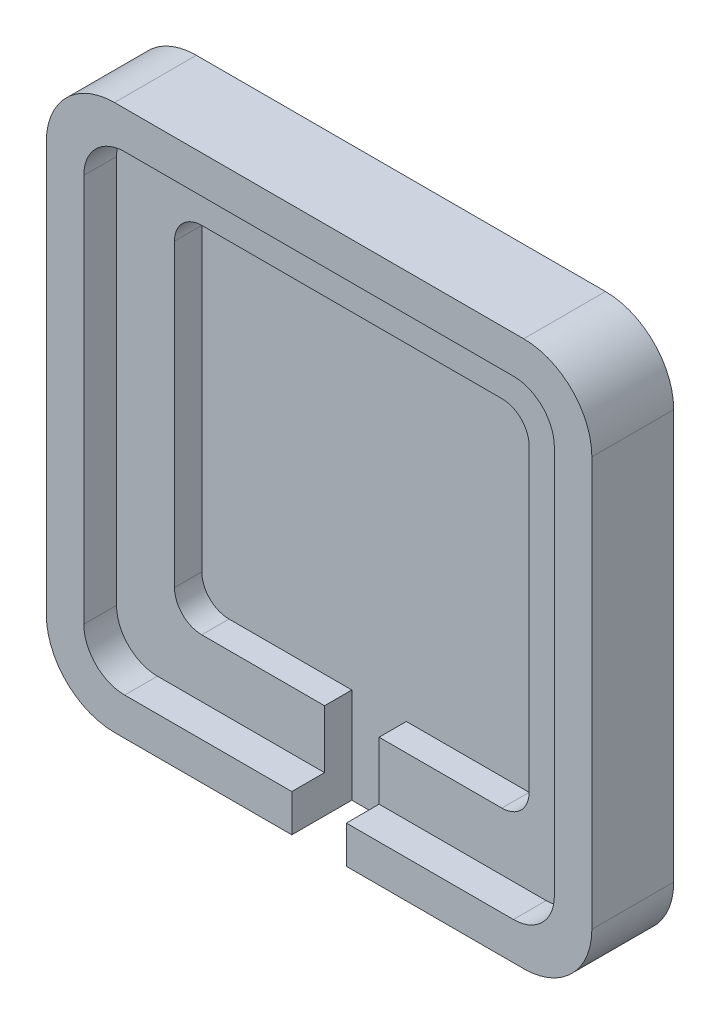
from build123d import *

# Parameters (mm, degrees)
SKIZZE1_W                       = 40
SKIZZE1_H                       = 40
AUFSATZ_LINEAR_AUSTRAGEN1_DEPTH = 6
VERRUNDUNG1_R                   = 5
SKIZZE2_W                       = 34.5
SKIZZE2_H                       = 34.5
SCHNITT_LINEAR_AUSTRAGEN1_DEPTH = 2.4
VERRUNDUNG2_R                   = 3
SKIZZE3_W                       = 26
SKIZZE3_H                       = 26
SCHNITT_LINEAR_AUSTRAGEN2_DEPTH = 2
VERRUNDUNG3_R                   = 2
SCHNITT_LINEAR_AUSTRAGEN3_REACH = 30.914
SKIZZE4_W                       = 4
SKIZZE4_H                       = 10.038850157


with BuildPart() as part:
    # Skizze1 → Aufsatz-Linear austragen1 (new body)
    with BuildSketch(Plane.XY):
        Rectangle(SKIZZE1_W, SKIZZE1_H)
    extrude(amount=AUFSATZ_LINEAR_AUSTRAGEN1_DEPTH)

    # Verrundung1
    verrundung1_edges = [part.edges().sort_by_distance(p)[0] for p in [
        (-20, 20, 3),
        (20, 20, 3),
        (20, -20, 3),
        (-20, -20, 3),
    ]]
    fillet(verrundung1_edges, radius=VERRUNDUNG1_R)

    # Skizze2 → Schnitt-Linear austragen1 (cut)
    with BuildSketch(Plane.XY.offset(6)):
        Rectangle(SKIZZE2_W, SKIZZE2_H)
    extrude(amount=-SCHNITT_LINEAR_AUSTRAGEN1_DEPTH, mode=Mode.SUBTRACT)

    # Verrundung2
    verrundung2_edges = [part.edges().sort_by_distance(p)[0] for p in [
        (-17.25, -17.25, 4.8),
        (-17.25, 17.25, 4.8),
        (17.25, 17.25, 4.8),
        (17.25, -17.25, 4.8),
    ]]
    fillet(verrundung2_edges, radius=VERRUNDUNG2_R)

    # Skizze3 → Schnitt-Linear austragen2 (cut)
    with BuildSketch(Plane.XY.offset(3.6)):
        Rectangle(SKIZZE3_W, SKIZZE3_H)
    extrude(amount=-SCHNITT_LINEAR_AUSTRAGEN2_DEPTH, mode=Mode.SUBTRACT)

    # Verrundung3
    verrundung3_edges = [part.edges().sort_by_distance(p)[0] for p in [
        (13, 13, 2.6),
        (13, -13, 2.6),
        (-13, -13, 2.6),
        (-13, 13, 2.6),
    ]]
    fillet(verrundung3_edges, radius=VERRUNDUNG3_R)

    # Schnitt-Linear austragen3: up to this face of the body (flat: up to its plane)
    schnitt_linear_austragen3_end = Plane(part.part.faces().sort_by_distance((0, 0, 1.6))[0])
    # Skizze4 → Schnitt-Linear austragen3 (cut, up to the picked face)
    with BuildSketch(Plane.XY.offset(6), mode=Mode.PRIVATE) as schnitt_linear_austragen3_sk1:
        with Locations((0, -17.296929977)):
            Rectangle(SKIZZE4_W, SKIZZE4_H)
    schnitt_linear_austragen3_tool1 = split(extrude(schnitt_linear_austragen3_sk1.sketch, amount=-SCHNITT_LINEAR_AUSTRAGEN3_REACH, mode=Mode.PRIVATE), bisect_by=schnitt_linear_austragen3_end, keep=Keep.BOTH, mode=Mode.PRIVATE)
    add(schnitt_linear_austragen3_tool1.solids().sort_by(Axis((0, -17.29693, 6), (0, 0, -1)))[0], mode=Mode.SUBTRACT)


solid = part.part
